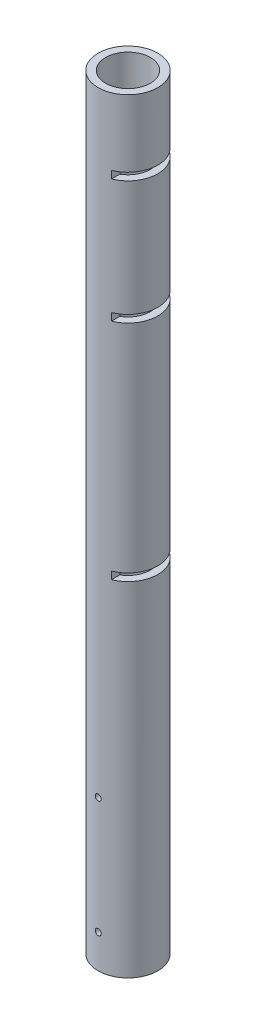
from build123d import *

# Parameters (mm, degrees)
SKETCH1_R               = 25.4
SKETCH1_R_2             = 19.05
BOSS_EXTRUDE1_DEPTH     = 650.875
CUT_EXTRUDE1_DEPTH      = 652.865465894
CUT_EXTRUDE1_DEPTH_BACK = 652.865465894
SKETCH2_R               = 2.54
SKETCH2_W               = 15.875
SKETCH2_H               = 6.35


with BuildPart() as part:
    # Sketch1 → Boss-Extrude1 (new body)
    with BuildSketch(Plane(origin=(0, 0, 0), x_dir=(1, 0, 0), z_dir=(0, 1, 0))):
        with Locations(Location((0, 0, 0), (0, 0, 270))):
            Circle(SKETCH1_R)
        with Locations(Location((0, 0, 0), (0, 0, 270))):
            Circle(SKETCH1_R_2, mode=Mode.SUBTRACT)
    extrude(amount=BOSS_EXTRUDE1_DEPTH)

    # Sketch2 → Cut-Extrude1 (cut, two sides: drawn at the far end of the back side and taken through both)
    with BuildSketch(Plane.XY.offset(-CUT_EXTRUDE1_DEPTH_BACK)):
        with Locations((0, 28.575)):
            Circle(SKETCH2_R)
        with Locations((0, 127.79375)):
            Circle(SKETCH2_R)
        with Locations((17.4625, 590.55)):
            Rectangle(SKETCH2_W, SKETCH2_H)
        with Locations((17.4625, 485.775)):
            Rectangle(SKETCH2_W, SKETCH2_H)
        with Locations((17.4625, 295.275)):
            Rectangle(SKETCH2_W, SKETCH2_H)
    extrude(amount=CUT_EXTRUDE1_DEPTH + CUT_EXTRUDE1_DEPTH_BACK, mode=Mode.SUBTRACT)


solid = part.part
